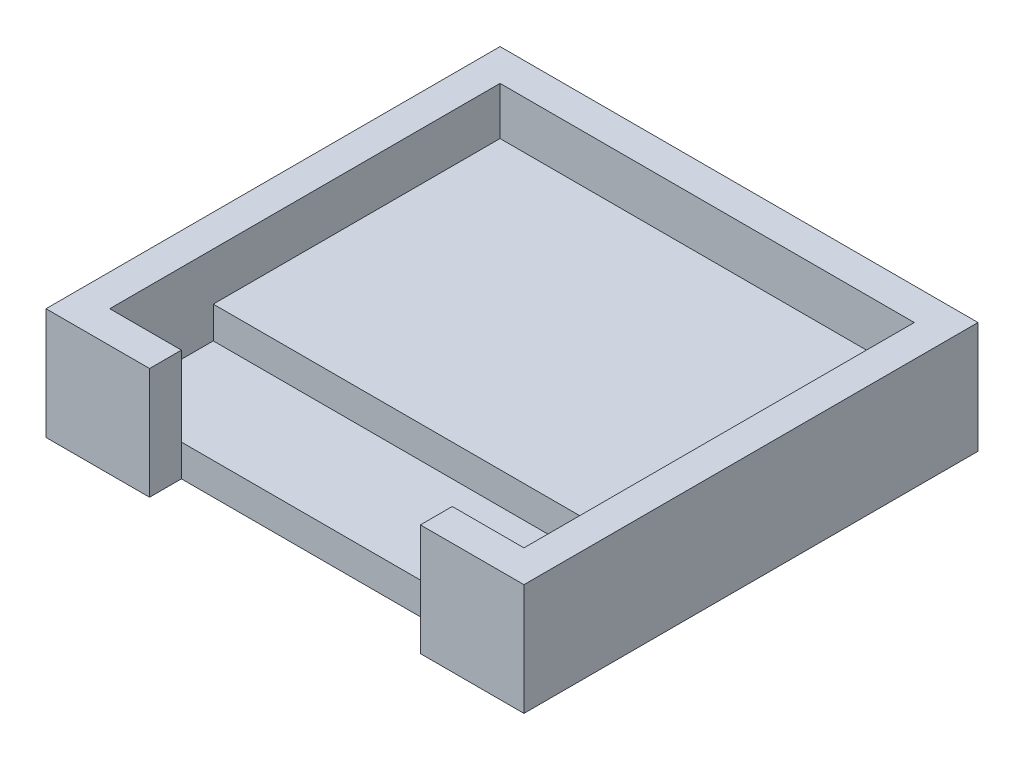
from build123d import *

# Parameters (mm, degrees)
BOSS_EXTRUDE1_DEPTH = 7
BOSS_EXTRUDE2_DEPTH = 2
SKETCH1_5_W         = 26
SKETCH1_5_H         = 18
BOSS_EXTRUDE3_DEPTH = 4


with BuildPart() as part:
    # Sketch1 → Boss-Extrude1 (new body)
    with BuildSketch(Plane(origin=(0, 0, 0), x_dir=(1, 0, 0), z_dir=(0, 1, 0))):
        Polygon((0, 0), (0, 6.5), (0, 24.5), (26, 24.5), (26, 6.5), (26, 0), (21.5, 0), (21.5, -2), (28, -2), (28, 26.5), (-2, 26.5), (-2, -2), (4.5, -2), (4.5, 0), align=None)
    extrude(amount=BOSS_EXTRUDE1_DEPTH)

    # Sketch1<3> → Boss-Extrude2 (add)
    with BuildSketch(Plane(origin=(0, 0, 0), x_dir=(1, 0, 0), z_dir=(0, 1, 0))):
        Polygon((26, 6.5), (0, 6.5), (0, 0), (4.5, 0), (21.5, 0), (26, 0), align=None)
    extrude(amount=BOSS_EXTRUDE2_DEPTH)

    # Sketch1<5> → Boss-Extrude3 (add)
    with BuildSketch(Plane(origin=(0, 0, 0), x_dir=(1, 0, 0), z_dir=(0, 1, 0))):
        with Locations((13, 15.5)):
            Rectangle(SKETCH1_5_W, SKETCH1_5_H)
    extrude(amount=BOSS_EXTRUDE3_DEPTH)


solid = part.part
